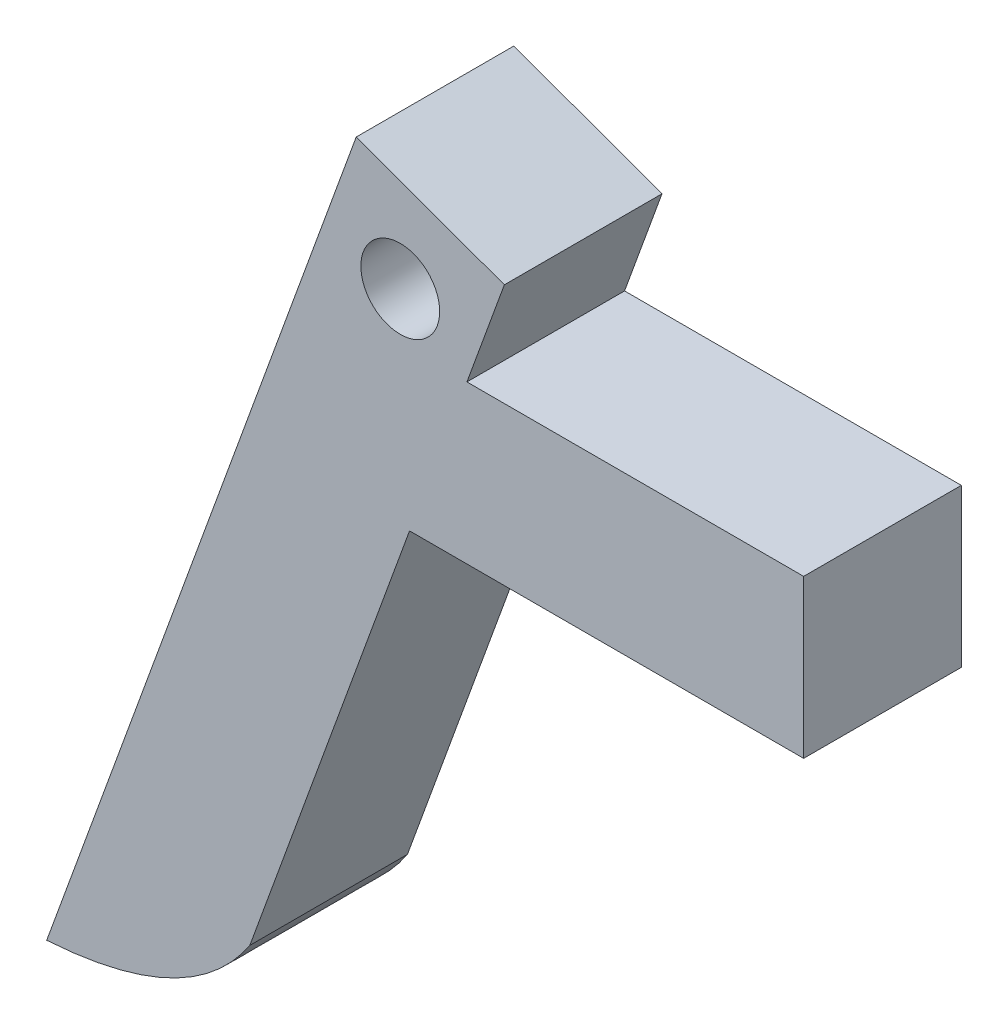
from build123d import *

# Parameters (mm, degrees)
SKETCH8_R           = 2.5
BOSS_EXTRUDE4_DEPTH = 10


with BuildPart() as part:
    # Sketch8 → Boss-Extrude4 (new body)
    with BuildSketch(Plane.XY):
        with BuildLine():
            Line((9.877608164, 0), (9.877608164, 10))
            Line((9.877608164, 10), (-11.482689494, 10))
            Line((-11.482689494, 10), (-9.108332934, 16.523491033))
            Line((-9.108332934, 16.523491033), (-18.505259142, 19.943692467))
            Line((-18.505259142, 19.943692467), (-38.139157526, -34))
            add(Edge.make_bspline(
                [(-38.139157526, -34), (-28.952640902, -33.410718861), (-25.255337047, -27.84003816)],
                knots=[0, 0, 0, 0.686191173, 0.686191173, 0.686191173], degree=2))
            Line((-25.255337047, -27.84003816), (-15.122391836, 0))
            Line((-15.122391836, 0), (9.877608164, 0))
        make_face()
        with Locations((-15.711667653, 13)):
            Circle(SKETCH8_R, mode=Mode.SUBTRACT)
    extrude(amount=BOSS_EXTRUDE4_DEPTH)


solid = part.part
